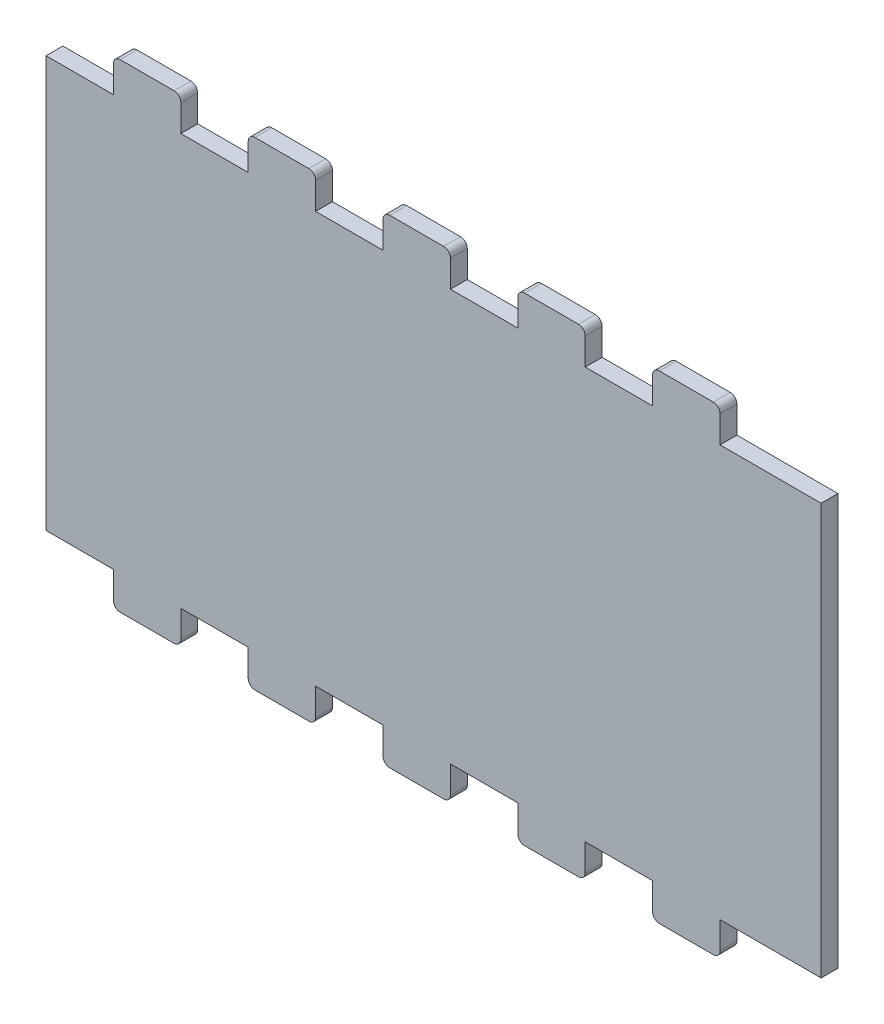
from build123d import *

# Parameters (mm, degrees)
SKETCH1_W            = 230
SKETCH1_H            = 122
BOSS_EXTRUDE1_DEPTH  = 5
SKETCH2_W            = 20
SKETCH2_H            = 10
BOSS_EXTRUDE2_DEPTH  = 5
FILLET1_R            = 2
FILLET1_OF_MIRROR1_R = 2


with BuildPart() as part:
    # Sketch1 → Boss-Extrude1 (new body)
    with BuildSketch(Plane.XY):
        with Locations((115, 61)):
            Rectangle(SKETCH1_W, SKETCH1_H)
    extrude(amount=BOSS_EXTRUDE1_DEPTH)

    # Sketch2 → Boss-Extrude2 (add)
    with BuildSketch(Plane.XY.offset(5)):
        with Locations((30, 127)):
            Rectangle(SKETCH2_W, SKETCH2_H)
        with Locations((70, 127)):
            Rectangle(SKETCH2_W, SKETCH2_H)
        with Locations((110, 127)):
            Rectangle(SKETCH2_W, SKETCH2_H)
        with Locations((150, 127)):
            Rectangle(SKETCH2_W, SKETCH2_H)
        with Locations((190, 127)):
            Rectangle(SKETCH2_W, SKETCH2_H)
    boss_extrude2 = extrude(amount=-BOSS_EXTRUDE2_DEPTH)

    # Fillet1
    fillet1_edges = [part.edges().sort_by_distance(p)[0] for p in [
        (40, 132, 2.5),
        (20, 132, 2.5),
        (80, 132, 2.5),
        (60, 132, 2.5),
        (120, 132, 2.5),
        (100, 132, 2.5),
        (160, 132, 2.5),
        (140, 132, 2.5),
        (200, 132, 2.5),
        (180, 132, 2.5),
    ]]
    fillet(fillet1_edges, radius=FILLET1_R)

    # Mirror1: Boss-Extrude2 across plane
    add(boss_extrude2.mirror(Plane.ZX.offset(61)))

    # Fillet1 of Mirror1
    fillet1_of_mirror1_edges = [part.edges().sort_by_distance(p)[0] for p in [
        (40, -10, 2.5),
        (20, -10, 2.5),
        (80, -10, 2.5),
        (60, -10, 2.5),
        (120, -10, 2.5),
        (100, -10, 2.5),
        (160, -10, 2.5),
        (140, -10, 2.5),
        (200, -10, 2.5),
        (180, -10, 2.5),
    ]]
    fillet(fillet1_of_mirror1_edges, radius=FILLET1_OF_MIRROR1_R)


solid = part.part
